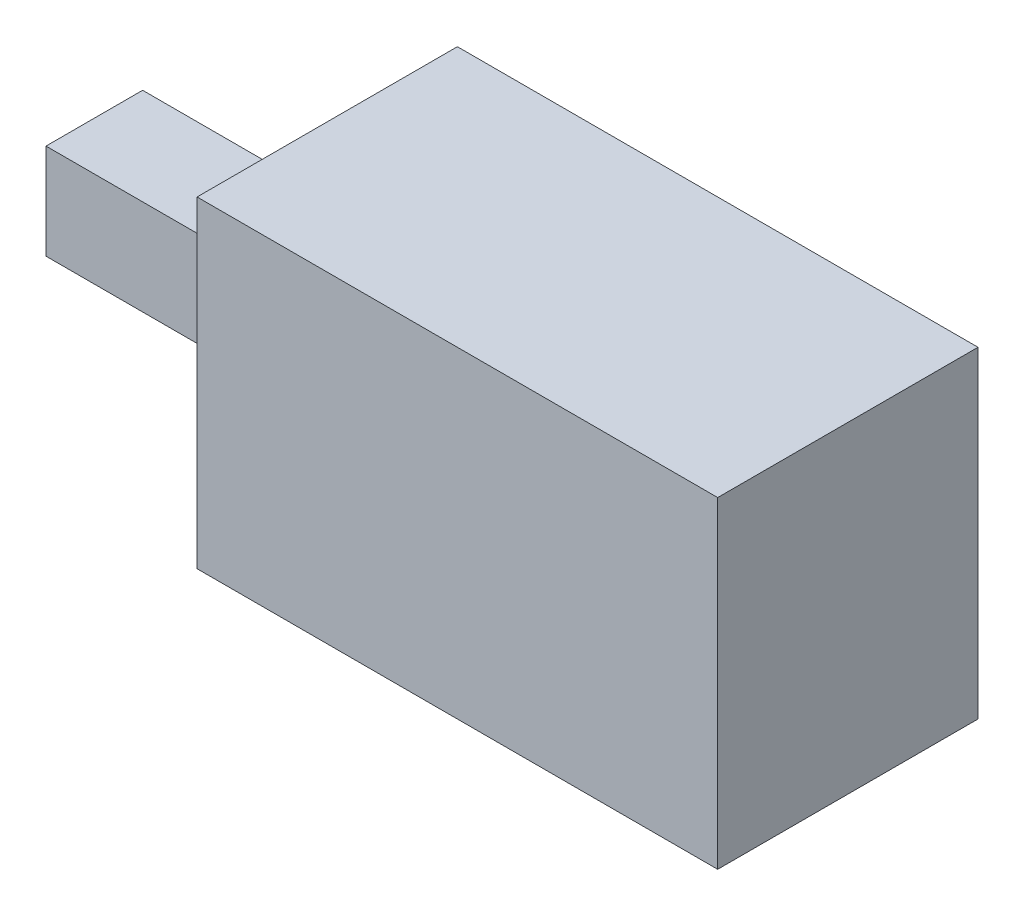
from build123d import *

# Parameters (mm, degrees)
SKETCH1_W           = 76
SKETCH1_H           = 38
BOSS_EXTRUDE1_DEPTH = 47
SKETCH2_W           = 14.106320236
SKETCH2_H           = 13.9243032
BOSS_EXTRUDE2_DEPTH = 34


with BuildPart() as part:
    # Sketch1 → Boss-Extrude1 (new body)
    with BuildSketch(Plane(origin=(0, 0, 0), x_dir=(1, 0, 0), z_dir=(0, 1, 0))):
        Rectangle(SKETCH1_W, SKETCH1_H)
    extrude(amount=BOSS_EXTRUDE1_DEPTH)

    # Sketch2 → Boss-Extrude2 (add)
    with BuildSketch(Plane.ZY.offset(38)):
        with Locations((0, 23.5)):
            Rectangle(SKETCH2_W, SKETCH2_H)
    extrude(amount=BOSS_EXTRUDE2_DEPTH)


solid = part.part
